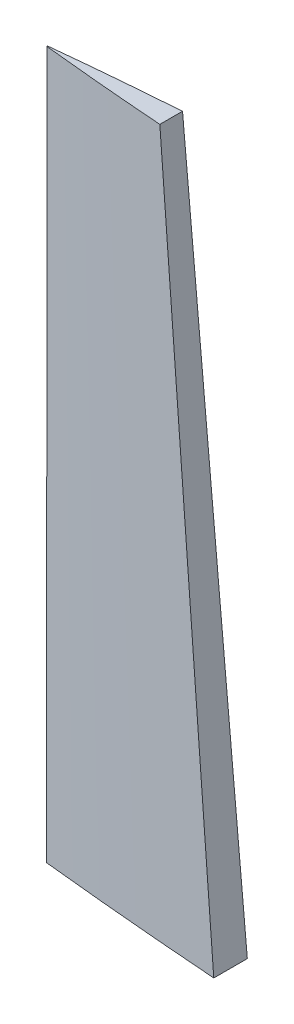
from build123d import *


with BuildPart() as part:
    # Sketch1 → Loft1 section 0
    with BuildSketch(Plane(origin=(0, 22, 0), x_dir=(1, 0, 0), z_dir=(0, 1, 0))):
        with BuildLine():
            Line((-113.6268, 4.217477276), (-113.6268, -4.217477276))
            add(Edge.make_bspline(
                [(-113.6268, -4.217477276), (-113.799174645, -4.205314432), (-116.358805181, -4.024705588), (-121.16388644, -3.652586205), (-127.877953579, -3.116556037), (-134.099217648, -2.590228815), (-139.759832884, -2.089895748), (-144.797698384, -1.625977164), (-149.157636731, -1.209892463), (-152.791882277, -0.852189171), (-155.660633245, -0.562562839), (-157.732470926, -0.349220721), (-158.984720765, -0.218589518), (-159.543830889, -0.159814978), (-159.684, -0.14508018)],
                knots=[0, 0, 0, 0, 0.011211572, 0.166483201, 0.31268616, 0.448210553, 0.571562716, 0.681381362, 0.776452467, 0.855722863, 0.918312437, 0.963524724, 0.990855635, 1, 1, 1, 1], degree=3))
            Line((-159.684, -0.14508018), (-159.684, 0.14508018))
            add(Edge.make_bspline(
                [(-113.6268, 4.217477276), (-113.799174645, 4.205314432), (-116.358805181, 4.024705588), (-121.16388644, 3.652586205), (-127.877953579, 3.116556037), (-134.099217648, 2.590228815), (-139.759832884, 2.089895748), (-144.797698384, 1.625977164), (-149.157636731, 1.209892463), (-152.791882277, 0.852189171), (-155.660633245, 0.562562839), (-157.732470926, 0.349220721), (-158.984720765, 0.218589518), (-159.543830889, 0.159814978), (-159.684, 0.14508018)],
                knots=[0, 0, 0, 0, 0.011211572, 0.166483201, 0.31268616, 0.448210553, 0.571562716, 0.681381362, 0.776452467, 0.855722863, 0.918312437, 0.963524724, 0.990855635, 1, 1, 1, 1], degree=3))
        make_face()
    # Sketch2 → Loft1 section 1
    with BuildSketch(Plane(origin=(0, 199.605, 0), x_dir=(1, 0, 0), z_dir=(0, 1, 0))):
        with BuildLine():
            Line((-128.54562, 2.851354621), (-128.54562, -2.851354621))
            add(Edge.make_bspline(
                [(-128.54562, -2.851354621), (-128.662159156, -2.843131559), (-130.392675737, -2.721025421), (-133.641298019, -2.46944272), (-138.180548645, -2.107043115), (-142.386624669, -1.751203485), (-146.213656886, -1.412937998), (-149.619660081, -1.099291638), (-152.567329871, -0.817984838), (-155.024372826, -0.576148577), (-156.963879739, -0.380337829), (-158.364609028, -0.236101359), (-159.211230866, -0.147784135), (-159.589234382, -0.108047808), (-159.684, -0.098085897)],
                knots=[0, 0, 0, 0, 0.011211572, 0.166483201, 0.31268616, 0.448210553, 0.571562716, 0.681381362, 0.776452467, 0.855722863, 0.918312437, 0.963524724, 0.990855635, 1, 1, 1, 1], degree=3))
            Line((-159.684, -0.098085897), (-159.684, 0.098085897))
            add(Edge.make_bspline(
                [(-128.54562, 2.851354621), (-128.662159156, 2.843131559), (-130.392675737, 2.721025421), (-133.641298019, 2.46944272), (-138.180548645, 2.107043115), (-142.386624669, 1.751203485), (-146.213656886, 1.412937998), (-149.619660081, 1.099291638), (-152.567329871, 0.817984838), (-155.024372826, 0.576148577), (-156.963879739, 0.380337829), (-158.364609028, 0.236101359), (-159.211230866, 0.147784135), (-159.589234382, 0.108047808), (-159.684, 0.098085897)],
                knots=[0, 0, 0, 0, 0.011211572, 0.166483201, 0.31268616, 0.448210553, 0.571562716, 0.681381362, 0.776452467, 0.855722863, 0.918312437, 0.963524724, 0.990855635, 1, 1, 1, 1], degree=3))
        make_face()
    loft()


solid = part.part
